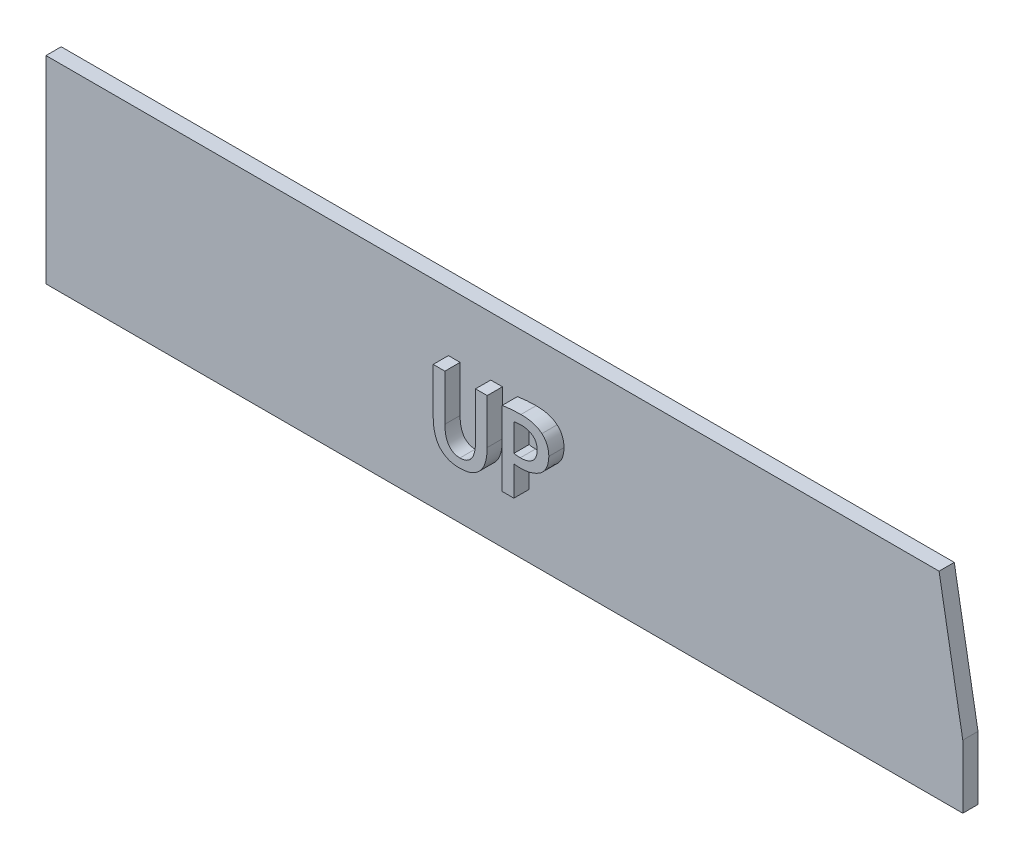
from build123d import *

# Parameters (mm, degrees)
EXTRUDE_1_DEPTH = 1
EXTRUDE_2_DEPTH = 1


with BuildPart() as part:
    # 草图2 → 凸台-拉伸1 (new body)
    with BuildSketch(Plane.XY):
        Polygon((-20.5, 1), (39.75, 1), (39.75, 5.162511336), (38.191712307, 14), (-20.5, 14), align=None)
    extrude(amount=EXTRUDE_1_DEPTH)

    # 草图3 → 凸台-拉伸2 (add)
    # profile 1 of 2: a face of its own
    with BuildSketch(Plane.XY.offset(1)):
        with BuildLine():
            Line((10.481008306, 5.180393764), (11.248205137, 5.180393764))
            Line((11.248205137, 5.180393764), (11.248205137, 7.138792231))
            add(Edge.make_bspline(
                [(11.248205137, 7.138792231), (11.280268125, 7.133099507), (11.346316296, 7.121372777), (11.449283839, 7.111830081), (11.558346323, 7.105847724), (11.633053511, 7.105955746), (11.671485638, 7.106011317)],
                knots=[0, 0, 0, 0, 0.918585764, 1.892241272, 2.915691322, 4, 4, 4, 4], degree=3))
            add(Edge.make_bspline(
                [(11.671485638, 7.106011317), (11.729785366, 7.106041643), (11.845025321, 7.106101586), (12.015487029, 7.122104566), (12.181692953, 7.148109054), (12.343324735, 7.187087519), (12.50082336, 7.237455337), (12.654314168, 7.298636251), (12.80298521, 7.372843607), (12.946131503, 7.457876132), (13.080836859, 7.556007269), (13.198248856, 7.673392446), (13.300029776, 7.806147684), (13.3829419, 7.956216651), (13.450592093, 8.121964161), (13.499729538, 8.304167199), (13.533442208, 8.502261401), (13.541101546, 8.639948748), (13.545068751, 8.711264826)],
                knots=[0, 0, 0, 0, 1.003522523, 1.98364375, 2.944869411, 3.898614004, 4.843729631, 5.790462383, 6.741287792, 7.702146141, 8.655643954, 9.602935836, 10.551034771, 11.527201242, 12.5464735, 13.626777097, 14.770773406, 16, 16, 16, 16], degree=3))
            add(Edge.make_bspline(
                [(13.545068751, 8.711264826), (13.542621314, 8.767407479), (13.537856522, 8.876708825), (13.513966748, 9.035247709), (13.476887205, 9.183894353), (13.427758946, 9.323326261), (13.361987826, 9.451787215), (13.285822021, 9.571837482), (13.194736975, 9.681556892), (13.124181783, 9.745091174), (13.08871946, 9.77702466)],
                knots=[0, 0, 0, 0, 1.126595518, 2.193312949, 3.209115705, 4.196248007, 5.151139266, 6.097382339, 7.043709754, 8, 8, 8, 8], degree=3))
            add(Edge.make_bspline(
                [(13.08871946, 9.77702466), (13.048819299, 9.809220998), (12.967763644, 9.874626629), (12.829758648, 9.955555414), (12.678205789, 10.024206618), (12.512562725, 10.081265594), (12.332183639, 10.124461936), (12.1373955, 10.153402083), (11.928575344, 10.173362723), (11.784600384, 10.174930082), (11.710223363, 10.175739775)],
                knots=[0, 0, 0, 0, 0.838628006, 1.70364077, 2.610636308, 3.559859354, 4.568055018, 5.643200099, 6.782484425, 8, 8, 8, 8], degree=3))
            add(Edge.make_bspline(
                [(11.710223363, 10.175739775), (11.647547246, 10.17461434), (11.525326605, 10.172419704), (11.347031706, 10.166981234), (11.178493577, 10.158615294), (11.019779498, 10.147008031), (10.870704987, 10.134275133), (10.731447222, 10.118184966), (10.602269579, 10.099521255), (10.519709866, 10.084629366), (10.480064406, 10.07747823)],
                knots=[0, 0, 0, 0, 1.217605855, 2.374374404, 3.464660226, 4.494999595, 5.465333604, 6.370582827, 7.217548217, 8, 8, 8, 8], degree=3))
            Line((10.480064406, 10.07747823), (10.481008306, 5.180393764))
        make_face()
        with BuildLine():
            add(Edge.make_bspline(
                [(11.248205137, 9.536781383), (11.27774721, 9.542613746), (11.344633086, 9.555818735), (11.458986924, 9.567908637), (11.598601931, 9.577170189), (11.700441396, 9.579944465), (11.755574845, 9.581446392)],
                knots=[0, 0, 0, 0, 0.708180311, 1.603383121, 2.702528978, 4, 4, 4, 4], degree=3))
            add(Edge.make_bspline(
                [(11.755574845, 9.581446392), (11.793073561, 9.580660892), (11.86632842, 9.579126393), (11.973460101, 9.568908362), (12.074759776, 9.550753083), (12.17072877, 9.526581699), (12.260478405, 9.494387574), (12.34469003, 9.455320337), (12.422963445, 9.40924223), (12.495093205, 9.356007774), (12.560949572, 9.296684339), (12.618080877, 9.228947702), (12.666017981, 9.154020887), (12.706384443, 9.072744901), (12.737473184, 8.984178001), (12.75980904, 8.888502208), (12.77423784, 8.786014927), (12.776639324, 8.715407993), (12.777872842, 8.679140859)],
                knots=[0, 0, 0, 0, 1.164286524, 2.274468469, 3.33712435, 4.356941393, 5.343590938, 6.292901648, 7.23538906, 8.158502959, 9.072142365, 9.981112688, 10.900594105, 11.827687296, 12.792632354, 13.80775062, 14.873954761, 16, 16, 16, 16], degree=3))
            add(Edge.make_bspline(
                [(12.777872842, 8.679140859), (12.776613433, 8.640363707), (12.774167963, 8.56506781), (12.76019411, 8.455822494), (12.736174009, 8.3537626), (12.704419521, 8.258318665), (12.663824966, 8.169544292), (12.613156623, 8.088395241), (12.553144539, 8.014538438), (12.485007553, 7.946950655), (12.408057089, 7.887831849), (12.324594044, 7.835136167), (12.233012254, 7.791830384), (12.134562282, 7.756148342), (12.029100063, 7.727426213), (11.916122917, 7.708209363), (11.796164858, 7.695683181), (11.713720416, 7.693741042), (11.671485638, 7.692746119)],
                knots=[0, 0, 0, 0, 1.10647952, 2.148516939, 3.135813804, 4.093347323, 5.013956832, 5.913991464, 6.814877829, 7.723438285, 8.645449828, 9.577866136, 10.534345172, 11.529217628, 12.562346088, 13.648092354, 14.795160789, 16, 16, 16, 16], degree=3))
            add(Edge.make_bspline(
                [(11.671485638, 7.692746119), (11.63021482, 7.692200684), (11.551388911, 7.691158922), (11.439442024, 7.698169967), (11.339043734, 7.709168238), (11.277392814, 7.723672298), (11.248205137, 7.730539021)],
                knots=[0, 0, 0, 0, 1.161518353, 2.218461969, 3.156558288, 4, 4, 4, 4], degree=3))
            Line((11.248205137, 7.730539021), (11.248205137, 9.536781383))
        make_face(mode=Mode.SUBTRACT)
    # profile 2 of 2: a face of its own
    with BuildSketch(Plane.XY.offset(1)):
        with BuildLine():
            Line((9.494613566, 10.144699032), (8.727416734, 10.144699032))
            Line((8.727416734, 10.144699032), (8.727416734, 7.120977159))
            add(Edge.make_bspline(
                [(8.727416734, 7.120977159), (8.72570679, 7.061167821), (8.722407633, 6.945772013), (8.709631742, 6.778889408), (8.688170718, 6.624510706), (8.658230337, 6.482310653), (8.619760507, 6.352261672), (8.572739739, 6.23481111), (8.517630595, 6.129485265), (8.454448576, 6.036324521), (8.382626209, 5.95552631), (8.305148113, 5.884790711), (8.220215209, 5.826242463), (8.129699085, 5.776987395), (8.031964883, 5.740430268), (7.92791034, 5.715069684), (7.817708054, 5.699600995), (7.742020532, 5.698067043), (7.703230938, 5.697280898)],
                knots=[0, 0, 0, 0, 1.442558911, 2.783265207, 4.033293762, 5.19797452, 6.283894868, 7.299176403, 8.243481286, 9.144954945, 10.005756174, 10.844503658, 11.66816234, 12.486940923, 13.323278702, 14.176003432, 15.065208066, 16, 16, 16, 16], degree=3))
            add(Edge.make_bspline(
                [(7.703230938, 5.697280898), (7.667274667, 5.697698259), (7.596903954, 5.698515082), (7.494090027, 5.713985225), (7.396870282, 5.740714967), (7.304631521, 5.777818192), (7.21742606, 5.824889909), (7.136059616, 5.88355453), (7.060255296, 5.953212566), (6.989139578, 6.033370677), (6.925239634, 6.126225718), (6.869986093, 6.231342171), (6.822149712, 6.348958788), (6.784585577, 6.479350068), (6.752971554, 6.621900529), (6.730985424, 6.776989679), (6.716631756, 6.944497921), (6.714275141, 7.060313631), (6.713056908, 7.120183655)],
                knots=[0, 0, 0, 0, 0.880869997, 1.723967724, 2.54076827, 3.348096003, 4.15667844, 4.964596865, 5.80091263, 6.676282017, 7.586647838, 8.557371955, 9.582678263, 10.694376867, 11.880403812, 13.160330013, 14.532054847, 16, 16, 16, 16], degree=3))
            Line((6.713056908, 7.120183655), (6.713056908, 10.144699032))
            Line((6.713056908, 10.144699032), (5.945860076, 10.144699032))
            Line((5.945860076, 10.144699032), (5.945860076, 7.166692176))
            add(Edge.make_bspline(
                [(5.945860076, 7.166692176), (5.947811599, 7.077745647), (5.951582552, 6.905873082), (5.976446082, 6.658325939), (6.014608186, 6.430215629), (6.067172501, 6.221450241), (6.133738874, 6.031572757), (6.214969708, 5.861101508), (6.31051972, 5.710146918), (6.421501903, 5.57950536), (6.544430093, 5.46706325), (6.67617651, 5.36843753), (6.819480172, 5.287205614), (6.971797177, 5.219666165), (7.13441307, 5.168482563), (7.306791456, 5.134357698), (7.4884993, 5.112474089), (7.613091953, 5.111823473), (7.676775907, 5.111490919)],
                knots=[0, 0, 0, 0, 1.389947096, 2.68581329, 3.884176986, 5.001519278, 6.046082896, 7.023506491, 7.946473535, 8.830015835, 9.69383004, 10.545329235, 11.396344648, 12.262399475, 13.145009074, 14.054291982, 15.00547603, 16, 16, 16, 16], degree=3))
            add(Edge.make_bspline(
                [(7.676775907, 5.111490919), (7.743278786, 5.112273586), (7.873172166, 5.113802291), (8.063018751, 5.134646007), (8.242559022, 5.17174834), (8.412356909, 5.222999832), (8.571712956, 5.292121054), (8.721258262, 5.375818025), (8.860035095, 5.476399667), (8.989854742, 5.590728631), (9.106884057, 5.723770561), (9.2085838, 5.876673755), (9.294366864, 6.048926123), (9.364814239, 6.239771985), (9.420601689, 6.449185846), (9.460084235, 6.67781481), (9.487297433, 6.925232139), (9.491500008, 7.096800861), (9.493669666, 7.185376411)],
                knots=[0, 0, 0, 0, 1.013962662, 1.980471211, 2.907472823, 3.806985122, 4.680561309, 5.551651082, 6.415505808, 7.289926821, 8.185106327, 9.109702809, 10.082849364, 11.113391155, 12.207519227, 13.383461846, 14.649163417, 16, 16, 16, 16], degree=3))
            Line((9.493669666, 7.185376411), (9.494613566, 10.144699032))
        make_face()
    extrude(amount=EXTRUDE_2_DEPTH)


solid = part.part
